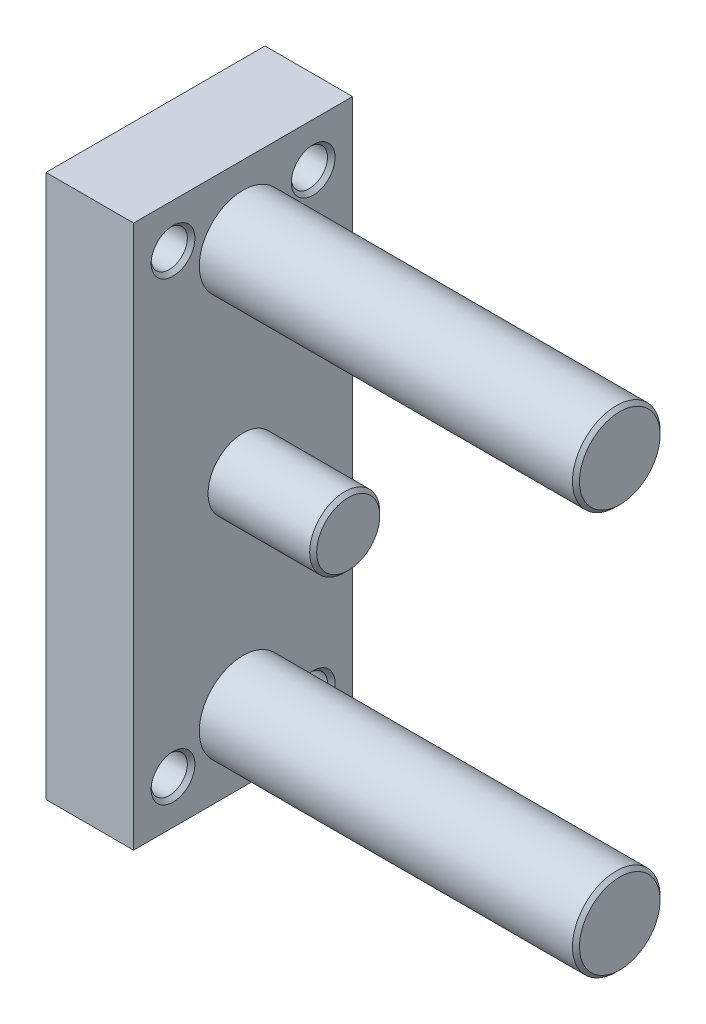
from build123d import *

# Parameters (mm, degrees)
SKETCH_1_W                  = 25
SKETCH_1_H                  = 62
EXTRUDE_1_DEPTH             = 10
PATTERN_LINEAR_1_COUNT      = 2
PATTERN_LINEAR_1_PITCH      = 16
PATTERN_LINEAR_1_COUNT_DIR2 = 2
PATTERN_LINEAR_1_PITCH_DIR2 = 52


with BuildPart() as part:
    # 草图1 → 凸台-拉伸1 (new body)
    with BuildSketch(Plane(origin=(0, 0, 0), x_dir=(0, 0, -1), z_dir=(1, 0, 0))):
        Rectangle(SKETCH_1_W, SKETCH_1_H)
    extrude(amount=EXTRUDE_1_DEPTH)

    # 草图2 → 切除-旋转1 (revolve, cut)
    with BuildSketch(Plane(origin=(0, 26, 0), x_dir=(1, 0, 0), z_dir=(0, 1, 0))):
        Polygon((0, 8), (0, 10.5), (0.433, 10.067), (9.567, 10.067), (10, 10.5), (10, 8), align=None)
    cut_revolve_1 = revolve(axis=Axis((10, 26, -8), (-1, 0, 0)), mode=Mode.SUBTRACT)

    # 阵列(线性)1: Cut-Revolve 1 2 × 2
    with Locations(*[(0, -j * PATTERN_LINEAR_1_PITCH_DIR2, i * PATTERN_LINEAR_1_PITCH) for i in range(PATTERN_LINEAR_1_COUNT) for j in range(PATTERN_LINEAR_1_COUNT_DIR2) if (i, j) != (0, 0)]):
        add(cut_revolve_1, mode=Mode.SUBTRACT)

    # 草图4 → 切除-旋转2 (revolve, cut)
    with BuildSketch(Plane(origin=(0, 23, 0), x_dir=(1, 0, 0), z_dir=(0, 1, 0))):
        Polygon((0, 0), (0, 3.8), (5.555555556, 3.8), (5.555555556, 3.5), (2.055555556, 3.5), (1.555555556, 3), (1.555555556, 1.5), (4.155555556, 1.5), (5.021580959, 0), align=None)
    revolve(axis=Axis((5.021580959, 23, 0), (-1, 0, 0)), mode=Mode.SUBTRACT)

    # 草图5 → 切除-旋转3 (revolve, cut)
    with BuildSketch(Plane(origin=(0, 0, 0), x_dir=(1, 0, 0), z_dir=(0, 1, 0))):
        Polygon((0, 0), (0, 3.8), (5.555555556, 3.8), (5.555555556, 3.5), (2.055555556, 3.5), (1.555555556, 3), (1.555555556, 1.5), (4.155555556, 1.5), (5.021580959, 0), align=None)
    revolve(axis=Axis((5.021580959, 0, 0), (-1, 0, 0)), mode=Mode.SUBTRACT)

    # 草图6 → 切除-旋转4 (revolve, cut)
    with BuildSketch(Plane(origin=(0, -23, 0), x_dir=(1, 0, 0), z_dir=(0, 1, 0))):
        Polygon((0, 0), (0, 3.8), (5.555555556, 3.8), (5.555555556, 3.5), (2.055555556, 3.5), (1.555555556, 3), (1.555555556, 1.5), (4.155555556, 1.5), (5.021580959, 0), align=None)
    revolve(axis=Axis((5.021580959, -23, 0), (-1, 0, 0)), mode=Mode.SUBTRACT)

    # 草图7 → 旋转1 (revolve)
    with BuildSketch(Plane(origin=(0, 0, 0), x_dir=(1, 0, 0), z_dir=(0, 1, 0))):
        Polygon((10, 0), (10, 4), (21.6, 4), (22, 3.6), (22, 0), align=None)
    revolve(axis=Axis((22, 0, 0), (-1, 0, 0)))

    # 草图8 → 旋转2 (revolve)
    with BuildSketch(Plane(origin=(0, -23, 0), x_dir=(1, 0, 0), z_dir=(0, 1, 0))):
        Polygon((10, 0), (10, 5), (52.6, 5), (53, 4.6), (53, 0), align=None)
    revolve(axis=Axis((53, -23, 0), (-1, 0, 0)))

    # 草图9 → 旋转3 (revolve)
    with BuildSketch(Plane(origin=(0, 23, 0), x_dir=(1, 0, 0), z_dir=(0, 1, 0))):
        Polygon((10, 0), (10, 5), (52.6, 5), (53, 4.6), (53, 0), align=None)
    revolve(axis=Axis((53, 23, 0), (-1, 0, 0)))


solid = part.part
